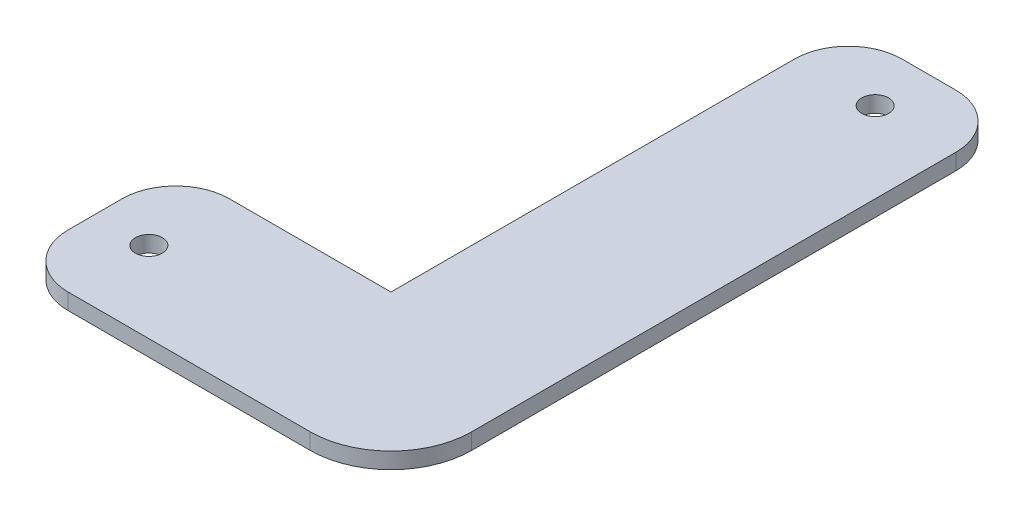
from build123d import *

# Parameters (mm, degrees)
BOSS_EXTRUDE1_DEPTH = 3
FILLET1_R           = 10
FILLET2_R           = 15
SKETCH2_R           = 2.5
CUT_EXTRUDE1_DEPTH  = 135.662541191


with BuildPart() as part:
    # Sketch1 → Boss-Extrude1 (new body)
    with BuildSketch(Plane(origin=(0, 0, 0), x_dir=(1, 0, 0), z_dir=(0, 1, 0))):
        Polygon((0, 115), (-30, 115), (-30, 30), (-70, 30), (-70, 0), (0, 0), align=None)
    extrude(amount=BOSS_EXTRUDE1_DEPTH)

    # Fillet1
    fillet1_edges = [part.edges().sort_by_distance(p)[0] for p in [
        (0, 1.5, -115),
        (-30, 1.5, -115),
        (-70, 1.5, -30),
        (-70, 1.5, 0),
    ]]
    fillet(fillet1_edges, radius=FILLET1_R)

    # Fillet2
    fillet2_edges = [part.edges().sort_by_distance(p)[0] for p in [
        (0, 1.5, 0),
    ]]
    fillet(fillet2_edges, radius=FILLET2_R)

    # Sketch2 → Cut-Extrude1 (cut, through all)
    with BuildSketch(Plane(origin=(0, 3, 0), x_dir=(1, 0, 0), z_dir=(0, 1, 0))):
        with Locations(Location((-60, 15, 0), (0, 0, 270))):
            Circle(SKETCH2_R)
        with Locations(Location((-15, 105, 0), (0, 0, 270))):
            Circle(SKETCH2_R)
    extrude(amount=-CUT_EXTRUDE1_DEPTH, mode=Mode.SUBTRACT)


solid = part.part
